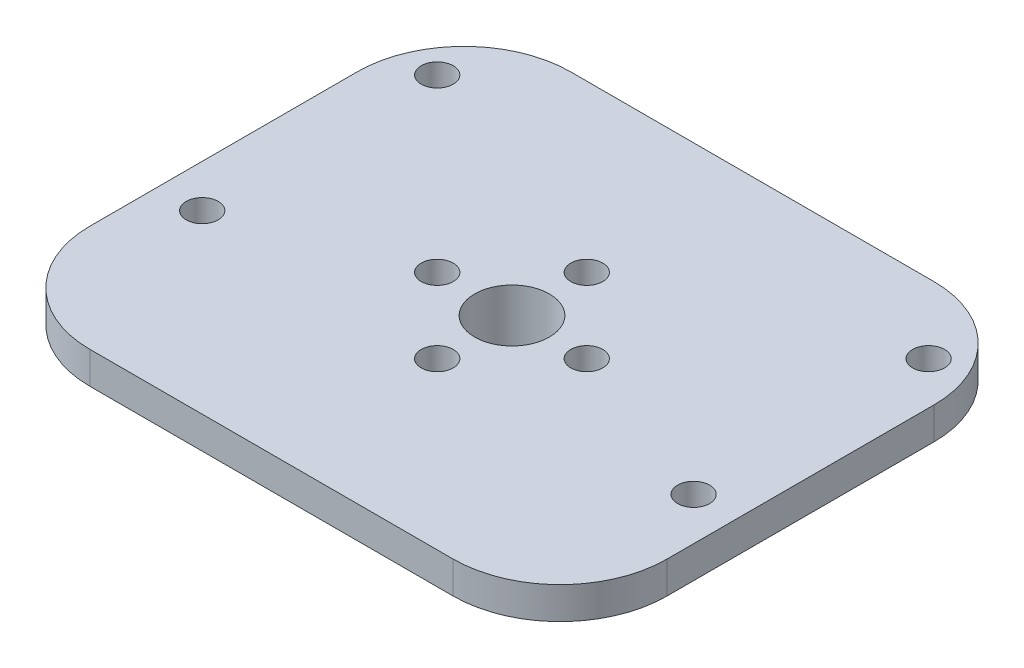
from build123d import *
from build123d.topology import SkipClean

# Parameters (mm, degrees)
SKETCH_1_W      = 54
SKETCH_1_H      = 45
SKETCH_1_R      = 1.5
SKETCH_1_R_2    = 3.5
EXTRUDE_1_DEPTH = 3
EXTRUDE_START   = 5
SKETCH_2_R      = 10
SKETCH_2_R_2    = 1.5
SKETCH_2_R_3    = 3.5
EXTRUDE_2_DEPTH = 5
FILLET_1_R      = 10
SKETCH_6_R      = 12
SKETCH_6_R_2    = 10
EXTRUDE_3_DEPTH = 5
EXTRUDE_START_2 = 4
SKETCH_7_R      = 12
SKETCH_7_R_2    = 10.5
EXTRUDE_4_DEPTH = 4
EXTRUDE_START_3 = 2
SKETCH_8_R      = 20
SKETCH_8_R_2    = 12
EXTRUDE_5_DEPTH = 2


with BuildPart() as part:
    # 草图1 → 凸台-拉伸1 (new body)
    with BuildSketch(Plane(origin=(0, 0, 0), x_dir=(1, 0, 0), z_dir=(0, 1, 0))):
        Rectangle(SKETCH_1_W, SKETCH_1_H)
        with Locations(Location((0, 7, 0), (0, 0, 270))):
            Circle(SKETCH_1_R, mode=Mode.SUBTRACT)
        with Locations(Location((7, 0, 0), (0, 0, 270))):
            Circle(SKETCH_1_R, mode=Mode.SUBTRACT)
        with Locations(Location((0, 0, 0), (0, 0, 270))):
            Circle(SKETCH_1_R_2, mode=Mode.SUBTRACT)
        with Locations(Location((0, -7, 0), (0, 0, 90))):
            Circle(SKETCH_1_R, mode=Mode.SUBTRACT)
        with Locations(Location((-7, 0, 0), (0, 0, 90))):
            Circle(SKETCH_1_R, mode=Mode.SUBTRACT)
        with Locations(Location((23, 16, 0), (0, 0, 270))):
            Circle(SKETCH_1_R, mode=Mode.SUBTRACT)
        with Locations(Location((23, -6, 0), (0, 0, 90))):
            Circle(SKETCH_1_R, mode=Mode.SUBTRACT)
        with Locations(Location((-23, -6, 0), (0, 0, 270))):
            Circle(SKETCH_1_R, mode=Mode.SUBTRACT)
        with Locations(Location((-23, 16, 0), (0, 0, 90))):
            Circle(SKETCH_1_R, mode=Mode.SUBTRACT)
    extrude(amount=EXTRUDE_1_DEPTH)

    # 草图2 → 凸台-拉伸2 (add)
    with SkipClean():  # the faces are left unmerged after this step: merging them gives an invalid solid
        with BuildSketch(Plane.XZ.offset(EXTRUDE_START)):
            with Locations(Location((0, 0, 0), (0, 0, 270))):
                Circle(SKETCH_2_R)
            with Locations(Location((0, 7, 0), (0, 0, 270))):
                Circle(SKETCH_2_R_2, mode=Mode.SUBTRACT)
            with Locations(Location((0, 0, 0), (0, 0, 270))):
                Circle(SKETCH_2_R_3, mode=Mode.SUBTRACT)
            with Locations(Location((-7, 0, 0), (0, 0, 270))):
                Circle(SKETCH_2_R_2, mode=Mode.SUBTRACT)
            with Locations(Location((0, -7, 0), (0, 0, 270))):
                Circle(SKETCH_2_R_2, mode=Mode.SUBTRACT)
            with Locations(Location((7, 0, 0), (0, 0, 270))):
                Circle(SKETCH_2_R_2, mode=Mode.SUBTRACT)
        extrude(amount=-EXTRUDE_2_DEPTH)

    # 圆角1
    fillet_1_edges = [part.edges().sort_by_distance(p)[0] for p in [
        (27, 1.5, 22.5),
        (-27, 1.5, 22.5),
        (-27, 1.5, -22.5),
        (27, 1.5, -22.5),
    ]]
    fillet(fillet_1_edges, radius=FILLET_1_R)

    # 草图6 → 凸台-拉伸3 (add)
    with SkipClean():  # the faces are left unmerged after this step: merging them gives an invalid solid
        with BuildSketch(Plane.XZ.offset(EXTRUDE_START)):
            with Locations(Location((0, 0, 0), (0, 0, 270))):
                Circle(SKETCH_6_R)
            Circle(SKETCH_6_R_2, mode=Mode.SUBTRACT)
        extrude(amount=-EXTRUDE_3_DEPTH)

    # 草图7 → 凸台-拉伸4 (add)
    with SkipClean():  # the faces are left unmerged after this step: merging them gives an invalid solid
        with BuildSketch(Plane.XZ.offset(5).offset(EXTRUDE_START_2)):
            with Locations(Location((0, 0, 0), (0, 0, 270))):
                Circle(SKETCH_7_R)
            with Locations(Location((0, 0, 0), (0, 0, 270))):
                Circle(SKETCH_7_R_2, mode=Mode.SUBTRACT)
        extrude(amount=-EXTRUDE_4_DEPTH)

    # 草图8 → 凸台-拉伸5 (add)
    with SkipClean():  # the faces are left unmerged after this step: merging them gives an invalid solid
        with BuildSketch(Plane.XZ.offset(EXTRUDE_START_3)):
            with Locations(Location((0, 0, 0), (0, 0, 270))):
                Circle(SKETCH_8_R)
            with Locations(Location((0, 0, 0), (0, 0, 270))):
                Circle(SKETCH_8_R_2, mode=Mode.SUBTRACT)
        extrude(amount=-EXTRUDE_5_DEPTH)


solid = part.part
